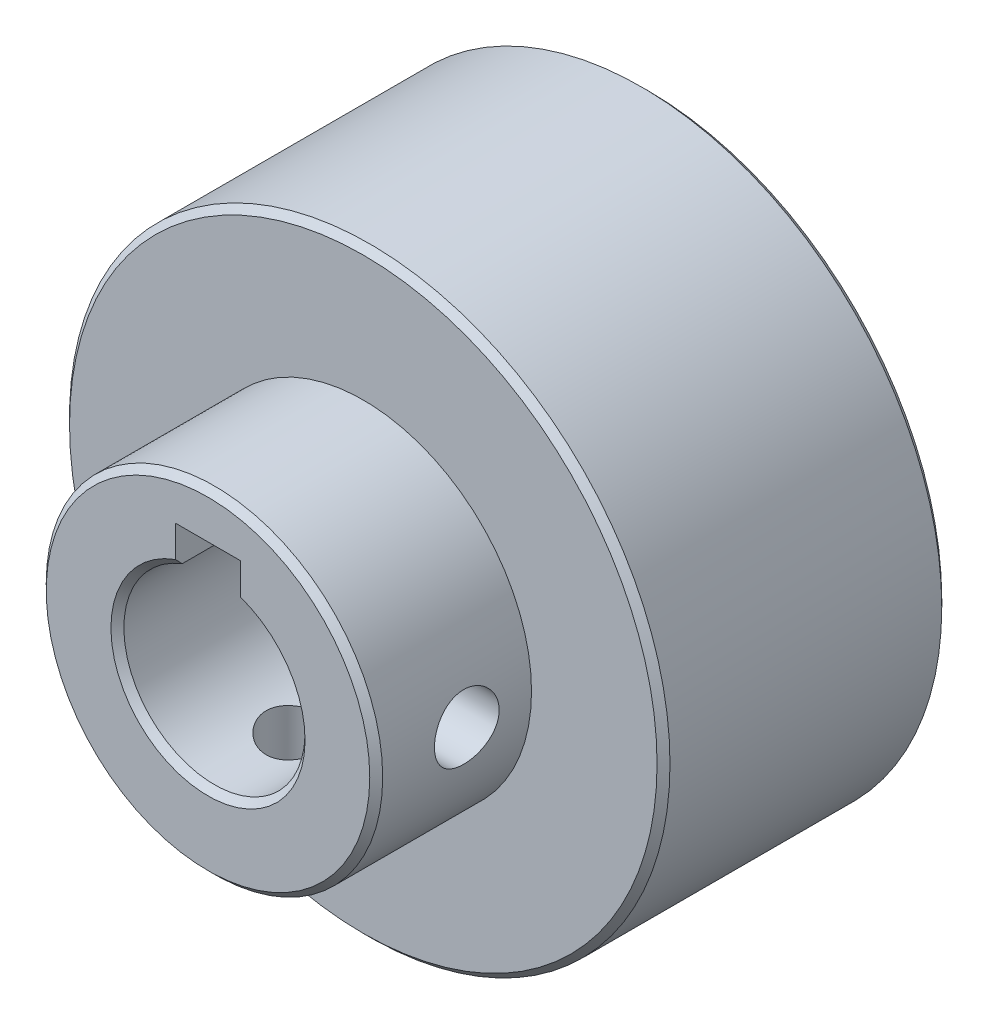
from build123d import *

# Parameters (mm, degrees)
SKETCH_1_R               = 23.2
SKETCH_1_R_2             = 7
EXTRUDE_1_DEPTH          = 34
SKETCH_2_R               = 34.674614003
SKETCH_2_R_2             = 13
CUT_EXTRUDE_1_DEPTH      = 12
HOLE_WIZARD_1_D          = 16
HOLE_WIZARD_1_DEPTH      = 15
SKETCH_3_W               = 5
SKETCH_3_H               = 10.2
CUT_EXTRUDE_2_DEPTH      = 48.249126976
SKETCH_4_W               = 2.5
SKETCH_4_H               = 23.2
PATTERN_CIRCULAR_2_COUNT = 6
PATTERN_CIRCULAR_1_COUNT = 2
PATTERN_CIRCULAR_1_ANGLE = 90
CHAMFER_1_SIZE           = 0.5


with BuildPart() as part:
    # 草图1 → 凸台-拉伸1 (new body)
    with BuildSketch(Plane.XY):
        Circle(SKETCH_1_R)
        Circle(SKETCH_1_R_2, mode=Mode.SUBTRACT)
    extrude(amount=EXTRUDE_1_DEPTH)

    # 草图2 → 切除-拉伸1 (cut)
    with BuildSketch(Plane.XY.offset(34)):
        Circle(SKETCH_2_R)
        Circle(SKETCH_2_R_2, mode=Mode.SUBTRACT)
    extrude(amount=-CUT_EXTRUDE_1_DEPTH, mode=Mode.SUBTRACT)

    # 孔1
    with Locations(Plane(origin=(0, 0, 0), x_dir=(-1, 0, 0), z_dir=(0, 0, -1))):
        with Locations((0, 0)):
            Hole(HOLE_WIZARD_1_D / 2, depth=HOLE_WIZARD_1_DEPTH)

    # 草图3 → 切除-拉伸2 (cut, through all)
    with BuildSketch(Plane.XY.offset(34)):
        with Locations((0, 4.4)):
            Rectangle(SKETCH_3_W, SKETCH_3_H)
    extrude(amount=-CUT_EXTRUDE_2_DEPTH, mode=Mode.SUBTRACT)

    # 草图4 → M6 螺纹孔1 (revolve, cut)
    with BuildSketch(Plane(origin=(0, 0, 27), x_dir=(0, 0, 1), z_dir=(1, 0, 0))):
        with Locations((1.25, 11.6)):
            Rectangle(SKETCH_4_W, SKETCH_4_H)
    hole_wizard_m6_1 = revolve(axis=Axis((0, 6.35, 27), (0, -1, 0)), mode=Mode.SUBTRACT)

    # 草图8 → M4 螺纹孔1 (revolve, cut)
    with BuildSketch(Plane.YZ.offset(-13)):
        Polygon((0, 0), (0, 11.091420021), (1.65, 10.1), (1.65, 0), align=None)
    hole_wizard_m4_1 = revolve(axis=Axis((-13, 0, -6.35), (0, 0, 1)), mode=Mode.SUBTRACT)

    # 阵列(圆周)2: M4 螺纹孔1 ×6 about axis
    pattern_circular_2_axis = Axis((0, 0, 0), (0, 0, 1))
    for i in range(1, PATTERN_CIRCULAR_2_COUNT):
        add(hole_wizard_m4_1.rotate(pattern_circular_2_axis, i * 360 / PATTERN_CIRCULAR_2_COUNT), mode=Mode.SUBTRACT)

    # 阵列(圆周)1: M6 螺纹孔1 ×2 about axis
    pattern_circular_1_axis = Axis((0, 0, 22), (0, 0, 1))
    for i in range(1, PATTERN_CIRCULAR_1_COUNT):
        add(hole_wizard_m6_1.rotate(pattern_circular_1_axis, i * PATTERN_CIRCULAR_1_ANGLE / (PATTERN_CIRCULAR_1_COUNT - 1)), mode=Mode.SUBTRACT)

    # 倒角1
    chamfer_1_edges = [part.edges().sort_by_distance(p)[0] for p in [
        (-23.2, 0, 22),
        (-13, 0, 34),
        (-23.2, 0, 0),
        (0, -8, 0),
        (0, -7, 34),
    ]]
    chamfer(chamfer_1_edges, length=CHAMFER_1_SIZE)


solid = part.part
